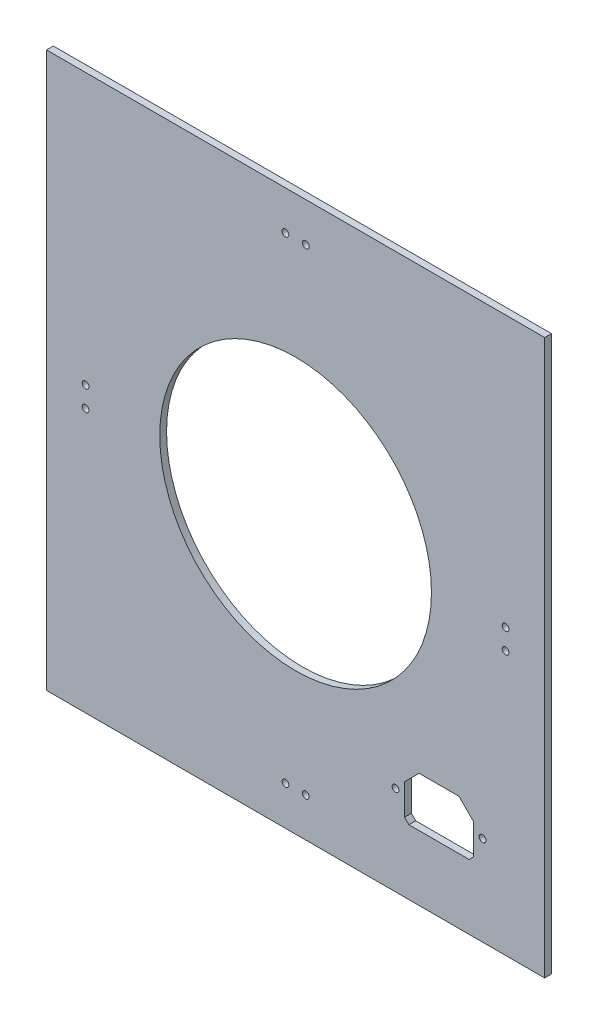
from build123d import *

# Parameters (mm, degrees)
SKETCH1_W           = 210
SKETCH1_H           = 245
BOSS_EXTRUDE1_DEPTH = 3
CUT_EXTRUDE1_DEPTH  = 3
CUT_EXTRUDE2_DEPTH  = 3
CUT_EXTRUDE3_DEPTH  = 246.456036562
SKETCH5_W           = 3
SKETCH5_H           = 245
BOSS_EXTRUDE2_DEPTH = 5
SKETCH6_W           = 3
SKETCH6_H           = 245
BOSS_EXTRUDE3_DEPTH = 5
SKETCH7_R           = 1.5
CUT_EXTRUDE4_DEPTH  = 10


with BuildPart() as part:
    # Sketch1 → Boss-Extrude1 (new body)
    with BuildSketch(Plane.XY):
        with Locations((-105, 4.541984733)):
            Rectangle(SKETCH1_W, SKETCH1_H)
    extrude(amount=BOSS_EXTRUDE1_DEPTH)

    # Sketch2 → Cut-Extrude1 (cut)
    with BuildSketch(Plane.XY.offset(3)):
        with BuildLine():
            ThreePointArc((-45, 4.541984733), (-62.573593129, 46.968391604), (-105, 64.541984733))
            Line((-105, 64.541984733), (-105, -55.458015267))
            ThreePointArc((-105, -55.458015267), (-62.573593129, -37.884422138), (-45, 4.541984733))
        make_face()
        with BuildLine():
            Line((-105, -55.458015267), (-105, 64.541984733))
            ThreePointArc((-105, 64.541984733), (-165, 4.541984733), (-105, -55.458015267))
        make_face()
    extrude(amount=-CUT_EXTRUDE1_DEPTH, mode=Mode.SUBTRACT)

    # Sketch3 → Cut-Extrude2 (cut)
    with BuildSketch(Plane.XY.offset(3)):
        Polygon((-41.653041136, -88.602014661), (-41.653041136, -68.081199381), (-50.153041136, -68.081199381), (-56.163448776, -74.091607021), (-56.163448776, -87.091607021), (-54.653041136, -88.602014661), align=None)
        Polygon((-41.653041136, -68.081199381), (-41.653041136, -67.381199381), (-50.442990629, -67.381199381), (-56.863448776, -73.801657527), (-56.863448776, -87.381556515), (-54.942990629, -89.302014661), (-41.653041136, -89.302014661), (-41.653041136, -88.602014661), (-54.653041136, -88.602014661), (-56.163448776, -87.091607021), (-56.163448776, -74.091607021), (-50.153041136, -68.081199381), align=None)
        Polygon((-33.153041136, -68.081199381), (-41.653041136, -68.081199381), (-41.653041136, -88.602014661), (-28.653041136, -88.602014661), (-27.142633496, -87.091607021), (-27.142633496, -74.091607021), align=None)
        Polygon((-32.863091642, -67.381199381), (-41.653041136, -67.381199381), (-41.653041136, -68.081199381), (-33.153041136, -68.081199381), (-27.142633496, -74.091607021), (-27.142633496, -87.091607021), (-28.653041136, -88.602014661), (-41.653041136, -88.602014661), (-41.653041136, -89.302014661), (-28.363091642, -89.302014661), (-26.442633496, -87.381556515), (-26.442633496, -73.801657527), align=None)
    extrude(amount=-CUT_EXTRUDE2_DEPTH, mode=Mode.SUBTRACT)

    # Sketch4 → Cut-Extrude3 (cut, through all)
    with BuildSketch(Plane.XY.offset(3)):
        with BuildLine():
            ThreePointArc((-60.863448776, -76.841607021), (-62.363448776, -78.341607021), (-60.863448776, -79.841607021))
            Line((-60.863448776, -79.841607021), (-60.863448776, -76.841607021))
        make_face()
        with BuildLine():
            Line((-60.863448776, -76.841607021), (-60.863448776, -79.841607021))
            ThreePointArc((-60.863448776, -79.841607021), (-59.802788604, -79.402267193), (-59.363448776, -78.341607021))
            ThreePointArc((-59.363448776, -78.341607021), (-59.802788604, -77.280946849), (-60.863448776, -76.841607021))
        make_face()
        with BuildLine():
            ThreePointArc((-22.442633496, -76.841607021), (-23.942633496, -78.341607021), (-22.442633496, -79.841607021))
            Line((-22.442633496, -79.841607021), (-22.442633496, -76.841607021))
        make_face()
        with BuildLine():
            Line((-22.442633496, -76.841607021), (-22.442633496, -79.841607021))
            ThreePointArc((-22.442633496, -79.841607021), (-21.381973324, -79.402267193), (-20.942633496, -78.341607021))
            ThreePointArc((-20.942633496, -78.341607021), (-21.381973324, -77.280946849), (-22.442633496, -76.841607021))
        make_face()
    extrude(amount=-CUT_EXTRUDE3_DEPTH, mode=Mode.SUBTRACT)

    # Sketch5 → Boss-Extrude2 (add)
    with BuildSketch(Plane(origin=(0, 0, 0), x_dir=(0, 0, -1), z_dir=(1, 0, 0))):
        with Locations((-1.5, 4.541984733)):
            Rectangle(SKETCH5_W, SKETCH5_H)
    extrude(amount=BOSS_EXTRUDE2_DEPTH)

    # Sketch6 → Boss-Extrude3 (add)
    with BuildSketch(Plane.ZY.offset(210)):
        with Locations((1.5, 4.541984733)):
            Rectangle(SKETCH6_W, SKETCH6_H)
    extrude(amount=BOSS_EXTRUDE3_DEPTH)

    # Sketch7 → Cut-Extrude4 (cut)
    with BuildSketch(Plane(origin=(0, 0, 0), x_dir=(-1, 0, 0), z_dir=(0, 0, -1))):
        with Locations((100.5, -100.70506409)):
            Circle(SKETCH7_R)
        with Locations((100.5, 109.789033556)):
            Circle(SKETCH7_R)
        with Locations((12.252951177, -1.473015267)):
            Circle(SKETCH7_R)
        with Locations((12.252951177, 7.526984733)):
            Circle(SKETCH7_R)
        with Locations((109.5, -100.70506409)):
            Circle(SKETCH7_R)
        with Locations((109.5, 109.789033556)):
            Circle(SKETCH7_R)
        with Locations((197.747048823, -1.473015267)):
            Circle(SKETCH7_R)
        with Locations((197.747048823, 7.526984733)):
            Circle(SKETCH7_R)
    extrude(amount=-CUT_EXTRUDE4_DEPTH, mode=Mode.SUBTRACT)


solid = part.part
